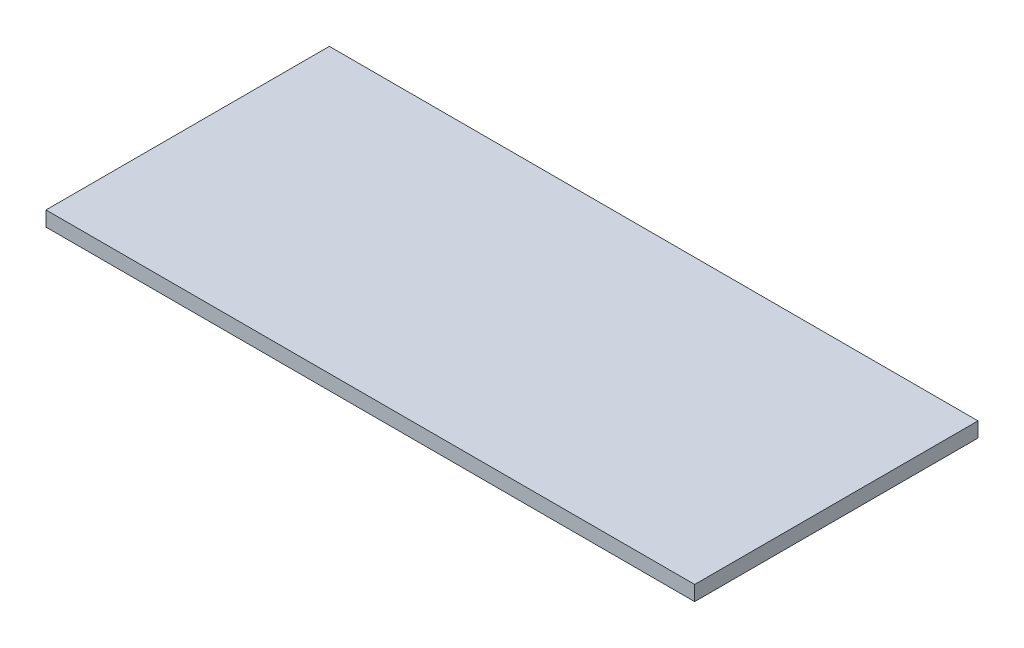
from build123d import *

# Parameters (mm, degrees)
SKETCH_1_W      = 870
SKETCH_1_H      = 380
EXTRUDE_1_DEPTH = 20


with BuildPart() as part:
    # 草图1 → 凸台-拉伸1 (new body)
    with BuildSketch(Plane(origin=(0, 0, 0), x_dir=(1, 0, 0), z_dir=(0, 1, 0))):
        with Locations((435, 190)):
            Rectangle(SKETCH_1_W, SKETCH_1_H)
    extrude(amount=EXTRUDE_1_DEPTH)


solid = part.part
